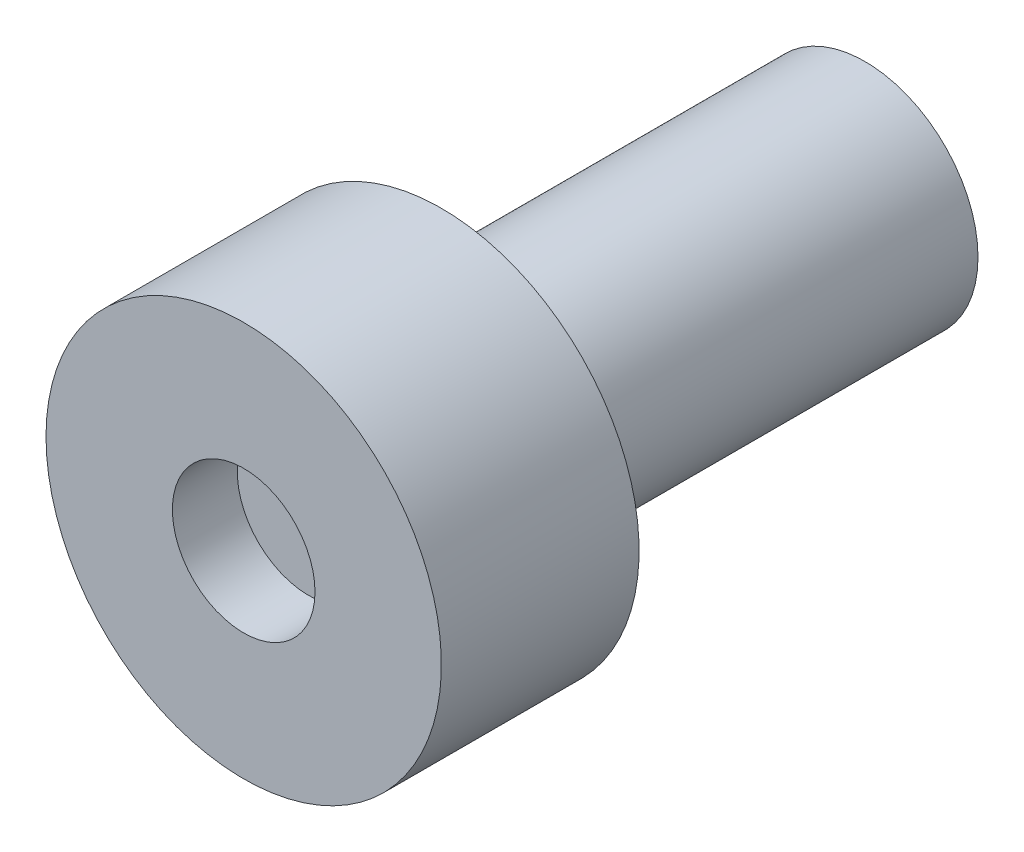
from build123d import *

# Parameters (mm, degrees)
SKETCH1_R           = 4
BOSS_EXTRUDE1_DEPTH = 15
SKETCH3_R           = 7
BOSS_EXTRUDE3_DEPTH = 7
SKETCH5_R           = 2.525
CUT_EXTRUDE2_DEPTH  = 2.3


with BuildPart() as part:
    # Sketch1 → Boss-Extrude1 (new body)
    with BuildSketch(Plane.XY):
        Circle(SKETCH1_R)
    extrude(amount=BOSS_EXTRUDE1_DEPTH)

    # Sketch3 → Boss-Extrude3 (add)
    with BuildSketch(Plane.XY.offset(15)):
        with Locations(Location((0, 0, 0), (0, 0, 180))):
            Circle(SKETCH3_R)
    extrude(amount=BOSS_EXTRUDE3_DEPTH)

    # Sketch5 → Cut-Extrude2 (cut)
    with BuildSketch(Plane.XY.offset(22)):
        Circle(SKETCH5_R)
    extrude(amount=-CUT_EXTRUDE2_DEPTH, mode=Mode.SUBTRACT)


solid = part.part
